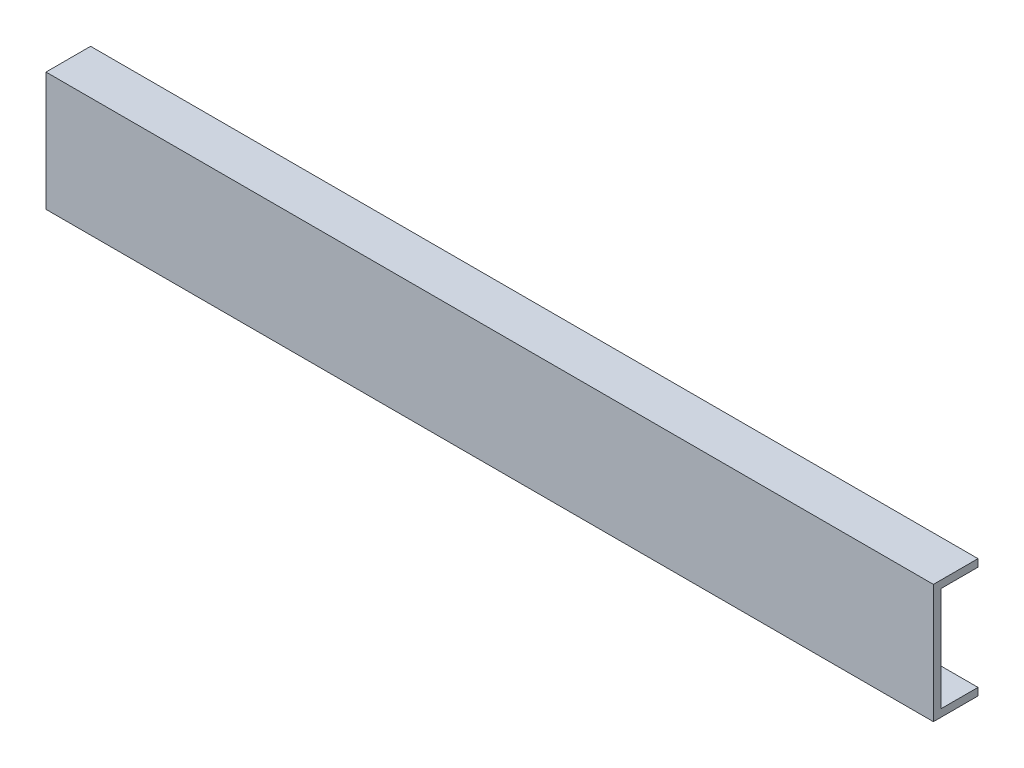
from build123d import *

# Parameters (mm, degrees)
BOSS_EXTRUDE1_DEPTH = 596.9


with BuildPart() as part:
    # Sketch1 → Boss-Extrude1 (new body)
    with BuildSketch(Plane(origin=(0, 0, 0), x_dir=(0, 0, -1), z_dir=(1, 0, 0))):
        Polygon((0, 65.837588936), (30, 65.837588936), (30, 60.837588936), (5, 60.837588936), (5, -9.162411064), (30, -9.162411064), (30, -14.162411064), (0, -14.162411064), align=None)
    extrude(amount=BOSS_EXTRUDE1_DEPTH)


solid = part.part
